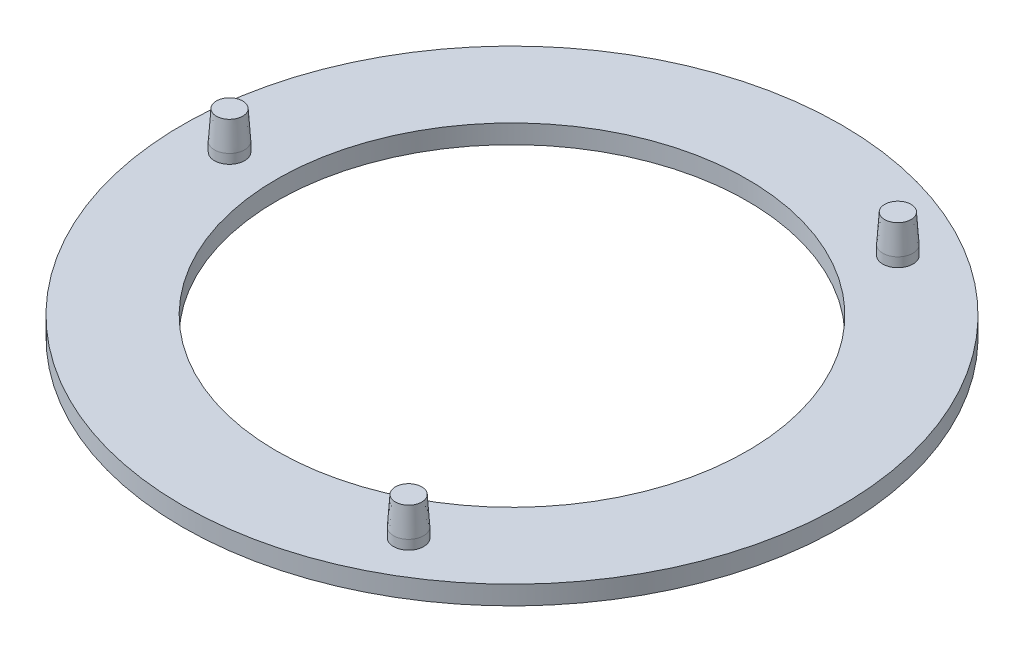
from build123d import *

# Parameters (mm, degrees)
SKETCH1_R           = 44.45
SKETCH1_R_2         = 31.75
BOSS_EXTRUDE1_DEPTH = 2.54
CIRPATTERN1_COUNT   = 3


with BuildPart() as part:
    # Sketch1 → Boss-Extrude1 (new body)
    with BuildSketch(Plane(origin=(0, 0, 0), x_dir=(1, 0, 0), z_dir=(0, 1, 0))):
        with Locations(Location((0, 0, 0), (0, 0, 270))):
            Circle(SKETCH1_R)
        with Locations(Location((0, 0, 0), (0, 0, 270))):
            Circle(SKETCH1_R_2, mode=Mode.SUBTRACT)
    extrude(amount=BOSS_EXTRUDE1_DEPTH)

    # Sketch4 → Revolve1 (revolve)
    with BuildSketch(Plane.XY, mode=Mode.PRIVATE) as revolve1_sk:
        Polygon((-38.1, 2.54), (-38.1, 7.62), (-39.878, 7.62), (-40.132, 3.81), (-40.132, 2.54), align=None)
    revolve1 = revolve(revolve1_sk.sketch.rotate(Axis((-38.1, 2.54, 0), (0, 1, 0)), 270), axis=Axis((-38.1, 2.54, 0), (0, 1, 0)))

    # CirPattern1: Revolve1 ×3 about axis
    cirpattern1_axis = Axis((0, 0, 0), (0, 1, 0))
    for i in range(1, CIRPATTERN1_COUNT):
        add(revolve1.rotate(cirpattern1_axis, i * 360 / CIRPATTERN1_COUNT))


solid = part.part
